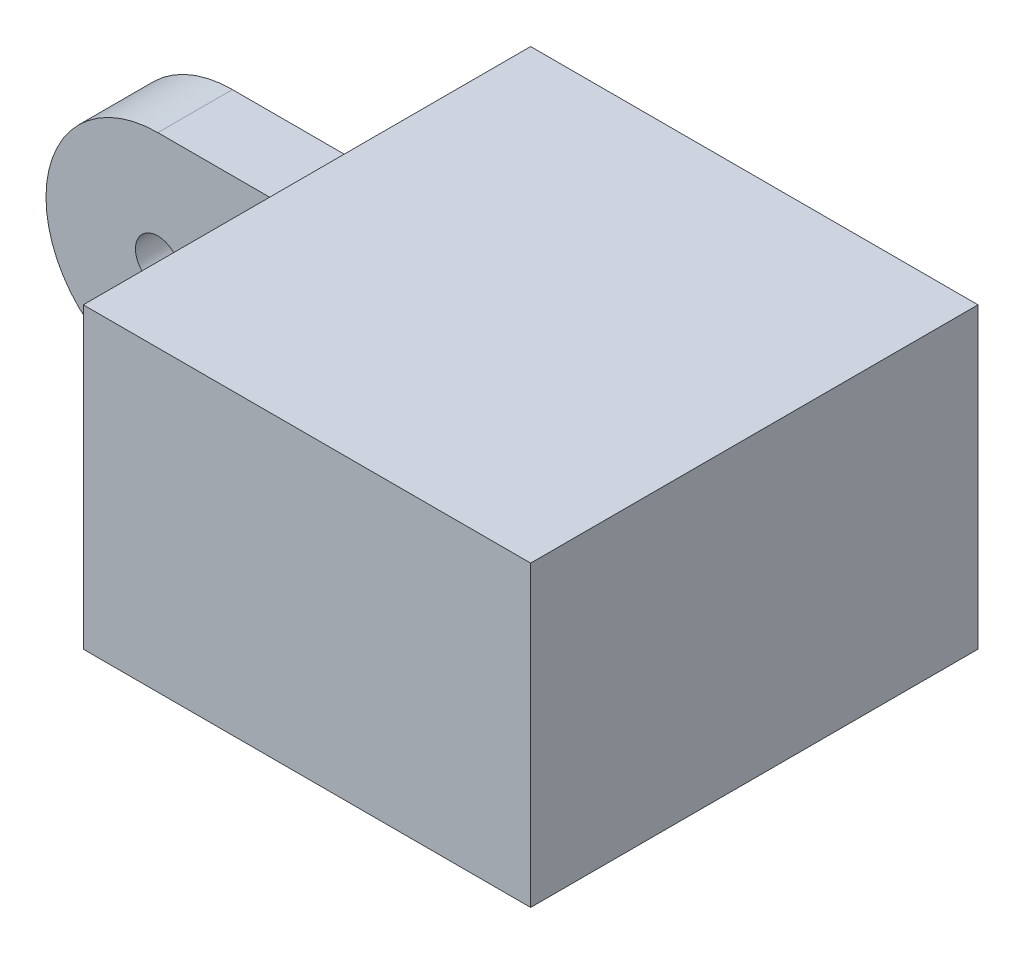
from build123d import *

# Parameters (mm, degrees)
SKETCH1_R           = 3
BOSS_EXTRUDE1_DEPTH = 10
SKETCH2_W           = 60
SKETCH2_H           = 40
BOSS_EXTRUDE2_DEPTH = 30
SKETCH3_W           = 60
SKETCH3_H           = 40
BOSS_EXTRUDE3_DEPTH = 20


with BuildPart() as part:
    # Sketch1 → Boss-Extrude1 (new body)
    with BuildSketch(Plane.XY):
        with BuildLine():
            Line((-30, -15), (-30, -20))
            Line((-30, -20), (30, -20))
            Line((30, -20), (30, 20))
            Line((30, 20), (-30, 20))
            Line((-30, 20), (-30, 15))
            Line((-30, 15), (-50, 15))
            ThreePointArc((-50, 15), (-65, 0), (-50, -15))
            Line((-50, -15), (-30, -15))
        make_face()
        with Locations((-50, 0)):
            Circle(SKETCH1_R, mode=Mode.SUBTRACT)
    extrude(amount=BOSS_EXTRUDE1_DEPTH)

    # Sketch2 → Boss-Extrude2 (add)
    with BuildSketch(Plane.XY.offset(10)):
        Rectangle(SKETCH2_W, SKETCH2_H)
    extrude(amount=BOSS_EXTRUDE2_DEPTH)

    # Sketch3 → Boss-Extrude3 (add)
    with BuildSketch(Plane(origin=(0, 0, 0), x_dir=(-1, 0, 0), z_dir=(0, 0, -1))):
        Rectangle(SKETCH3_W, SKETCH3_H)
    extrude(amount=BOSS_EXTRUDE3_DEPTH)


solid = part.part
